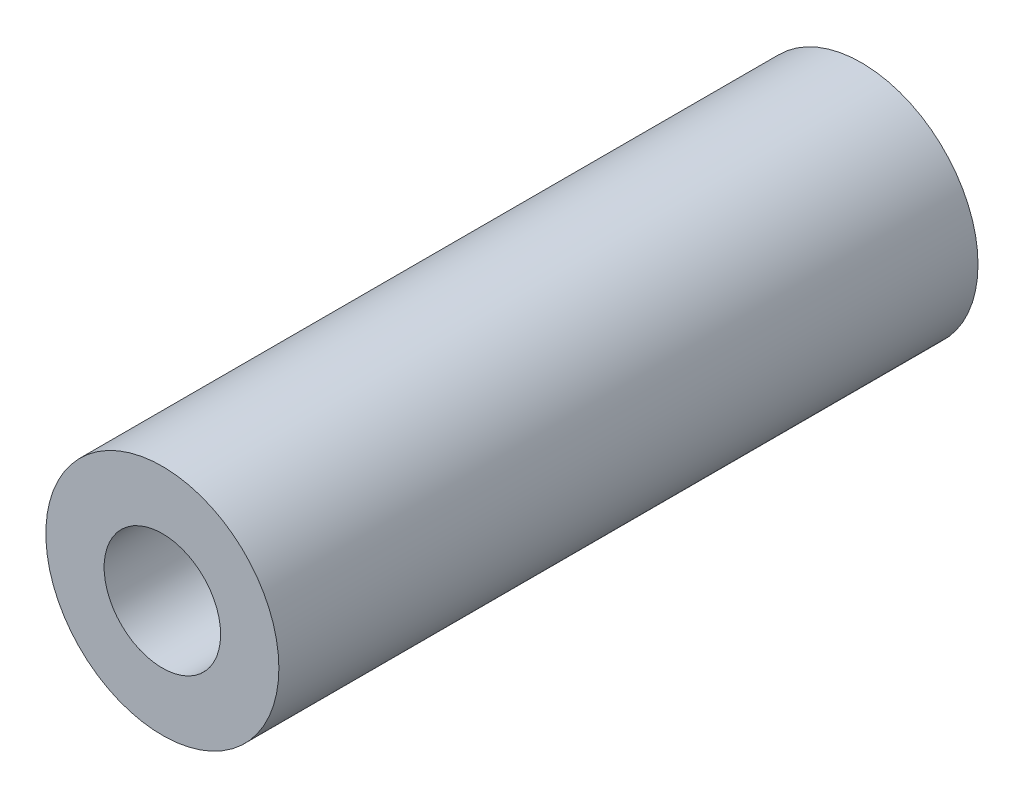
from build123d import *

# Parameters (mm, degrees)
SKETCH1_R           = 25
BOSS_EXTRUDE1_DEPTH = 150
SKETCH3_R           = 12.5
CUT_EXTRUDE2_DEPTH  = 100


with BuildPart() as part:
    # Sketch1 → Boss-Extrude1 (new body)
    with BuildSketch(Plane.XY):
        Circle(SKETCH1_R)
    extrude(amount=BOSS_EXTRUDE1_DEPTH)

    # Sketch3 → Cut-Extrude2 (cut)
    with BuildSketch(Plane.XY.offset(150)):
        Circle(SKETCH3_R)
    extrude(amount=-CUT_EXTRUDE2_DEPTH, mode=Mode.SUBTRACT)


solid = part.part
